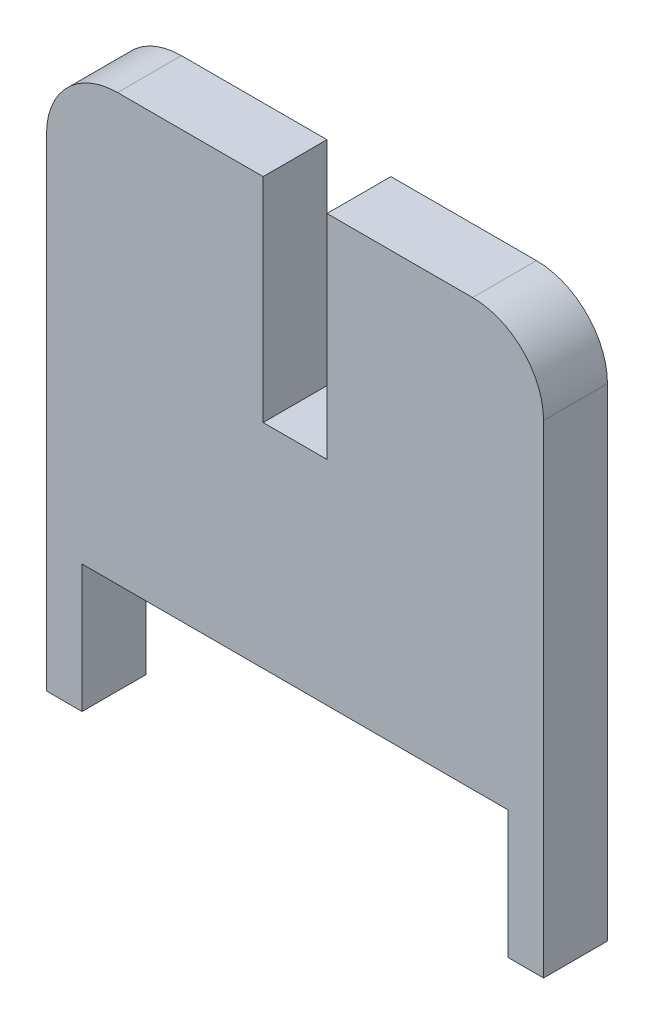
from build123d import *

# Parameters (mm, degrees)
SKETCH1_W           = 35
SKETCH1_H           = 30
SKETCH1_W_2         = 2.5
SKETCH1_H_2         = 9
BOSS_EXTRUDE1_DEPTH = 4.5
FILLET1_R           = 5
SKETCH2_W           = 4.5
SKETCH2_H           = 15
CUT_EXTRUDE1_DEPTH  = 4.5


with BuildPart() as part:
    # Sketch1 → Boss-Extrude1 (new body)
    with BuildSketch(Plane.XY):
        Rectangle(SKETCH1_W, SKETCH1_H)
        with Locations((-16.25, -19.5)):
            Rectangle(SKETCH1_W_2, SKETCH1_H_2)
        with Locations((16.25, -19.5)):
            Rectangle(SKETCH1_W_2, SKETCH1_H_2)
    extrude(amount=BOSS_EXTRUDE1_DEPTH)

    # Fillet1
    fillet1_edges = [part.edges().sort_by_distance(p)[0] for p in [
        (-17.5, 15, 2.25),
        (17.5, 15, 2.25),
    ]]
    fillet(fillet1_edges, radius=FILLET1_R)

    # Sketch2 → Cut-Extrude1 (cut)
    with BuildSketch(Plane.XY.offset(4.5)):
        with Locations((0, 7.5)):
            Rectangle(SKETCH2_W, SKETCH2_H)
    extrude(amount=-CUT_EXTRUDE1_DEPTH, mode=Mode.SUBTRACT)


solid = part.part
